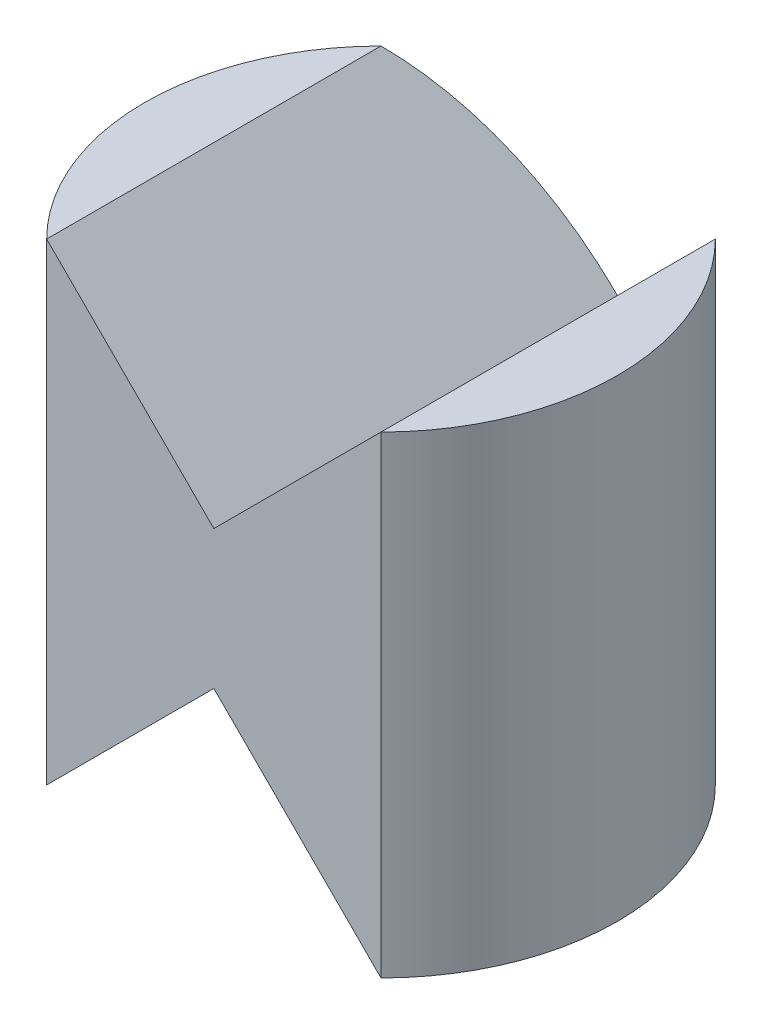
from build123d import *

# Parameters (mm, degrees)
BOSS_EXTRUDE1_DEPTH     = 5
CUT_EXTRUDE1_REACH      = 9.033
CUT_EXTRUDE1_END_RADIUS = 2.5


with BuildPart() as part:
    # Sketch1 → Boss-Extrude1 (new body)
    with BuildSketch(Plane(origin=(0, 0, 0), x_dir=(1, 0, 0), z_dir=(0, 1, 0))):
        with BuildLine():
            Line((-1.767766953, -1.767766953), (1.767766953, -1.767766953))
            ThreePointArc((1.767766953, -1.767766953), (0, 2.5), (-1.767766953, -1.767766953))
        make_face()
    extrude(amount=BOSS_EXTRUDE1_DEPTH)

    # Cut-Extrude1: up to this cylinder (the profile starts inside it)
    cut_extrude1_end = Plane(origin=(0, 2.5, 0), z_dir=(0, -1, 0)) * Cylinder(CUT_EXTRUDE1_END_RADIUS, 27.887488, mode=Mode.PRIVATE)
    # Sketch2 → Cut-Extrude1 (cut, up to the surface)
    with BuildSketch(Plane.XY.offset(1.767766953), mode=Mode.PRIVATE) as cut_extrude1_sk1:
        Polygon((-1.767766953, 0), (0, 1.767766953), (1.767766953, 0), align=None)
    cut_extrude1_tool1 = extrude(cut_extrude1_sk1.sketch, amount=-CUT_EXTRUDE1_REACH, mode=Mode.PRIVATE) & cut_extrude1_end
    add(cut_extrude1_tool1.solids().sort_by_distance((0, 0.589256, 1.767767))[0], mode=Mode.SUBTRACT)
    # Sketch2 → Cut-Extrude1 (cut, up to the surface)
    with BuildSketch(Plane.XY.offset(1.767766953), mode=Mode.PRIVATE) as cut_extrude1_sk2:
        Polygon((-1.767766953, 5), (0, 3.232233047), (1.767766953, 5), align=None)
    cut_extrude1_tool2 = extrude(cut_extrude1_sk2.sketch, amount=-CUT_EXTRUDE1_REACH, mode=Mode.PRIVATE) & cut_extrude1_end
    add(cut_extrude1_tool2.solids().sort_by_distance((0, 4.410744, 1.767767))[0], mode=Mode.SUBTRACT)


solid = part.part
